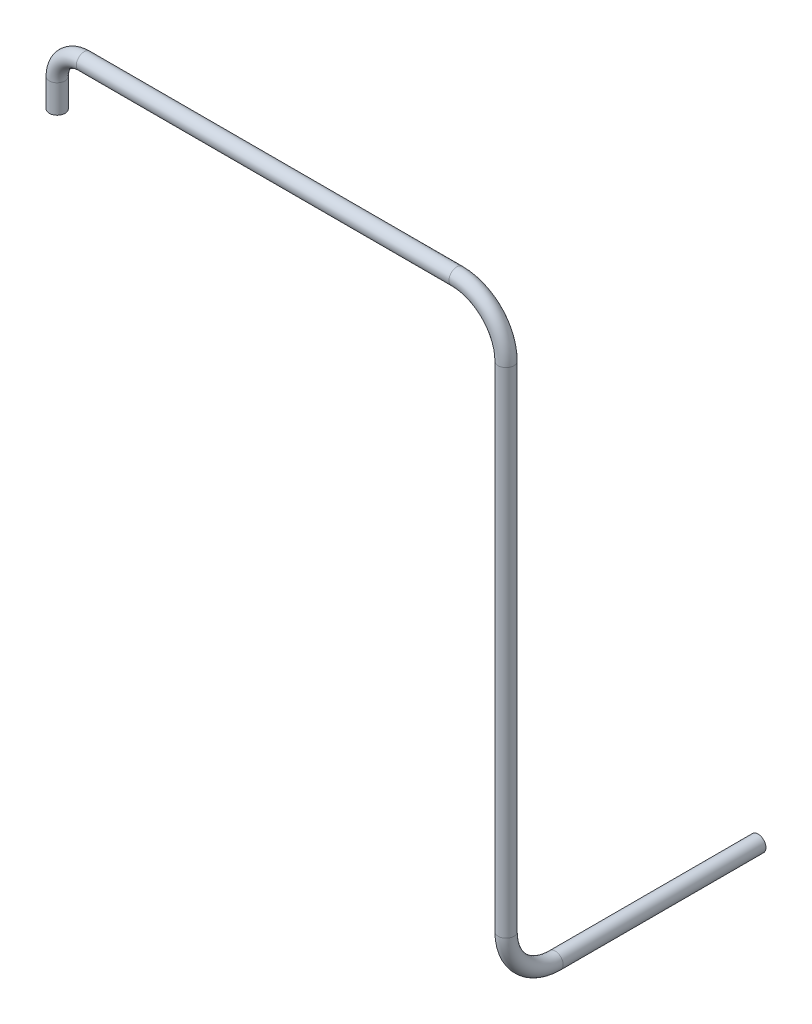
from build123d import *

# Parameters (mm, degrees)
SWEEP1_PROFILE_R                           = 4
HOLLOW_TUBE_OD_AND_WALL_PROVISIONAL_PROF_R = 3


with BuildPart() as part:
    # Sweep1: sweep along a curve in space
    with BuildLine() as sweep1_path:
        Line((0, 0, 0), (0, 14.279999871, 0))
        ThreePointArc((0, 14.279999871, 0), (4.018494954, 23.981504954, 0), (13.72, 28, 0))
        Line((13.72, 28, 0), (203.000001606, 28, 0))
        ThreePointArc((203.000001606, 28, 0), (220.677670568, 20.677669432, 0), (228, 3, 0))
        Line((228, 3, 0), (228, -248.000001606, 0))
        ThreePointArc((228, -248.000001606, 0), (228, -265.677670568, -7.322330568), (228, -273, -25))
        Line((228, -273, -25), (228, -273, -128))
    # Sweep1 profile (on start of the path) → Sweep1 (sweep)
    with BuildSketch(Plane.ZX):
        Circle(SWEEP1_PROFILE_R)
    sweep(path=sweep1_path.line)

    # Hollow_tube_OD_and_wall_PROVISIONAL: sweep along a curve in space
    with BuildLine() as hollow_tube_od_and_wall_provisional_path:
        Line((0, 0, 0), (0, 14.279999871, 0))
        ThreePointArc((0, 14.279999871, 0), (4.018494954, 23.981504954, 0), (13.72, 28, 0))
        Line((13.72, 28, 0), (203.000001606, 28, 0))
        ThreePointArc((203.000001606, 28, 0), (220.677670568, 20.677669432, 0), (228, 3, 0))
        Line((228, 3, 0), (228, -248.000001606, 0))
        ThreePointArc((228, -248.000001606, 0), (228, -265.677670568, -7.322330568), (228, -273, -25))
        Line((228, -273, -25), (228, -273, -128))
    # Hollow_tube_OD_and_wall_PROVISIONAL prof (on start of the path) → Hollow_tube_OD_and_wall_PROVISIONAL (sweep, cut)
    with BuildSketch(Plane.ZX):
        Circle(HOLLOW_TUBE_OD_AND_WALL_PROVISIONAL_PROF_R)
    sweep(path=hollow_tube_od_and_wall_provisional_path.line, mode=Mode.SUBTRACT)


solid = part.part
